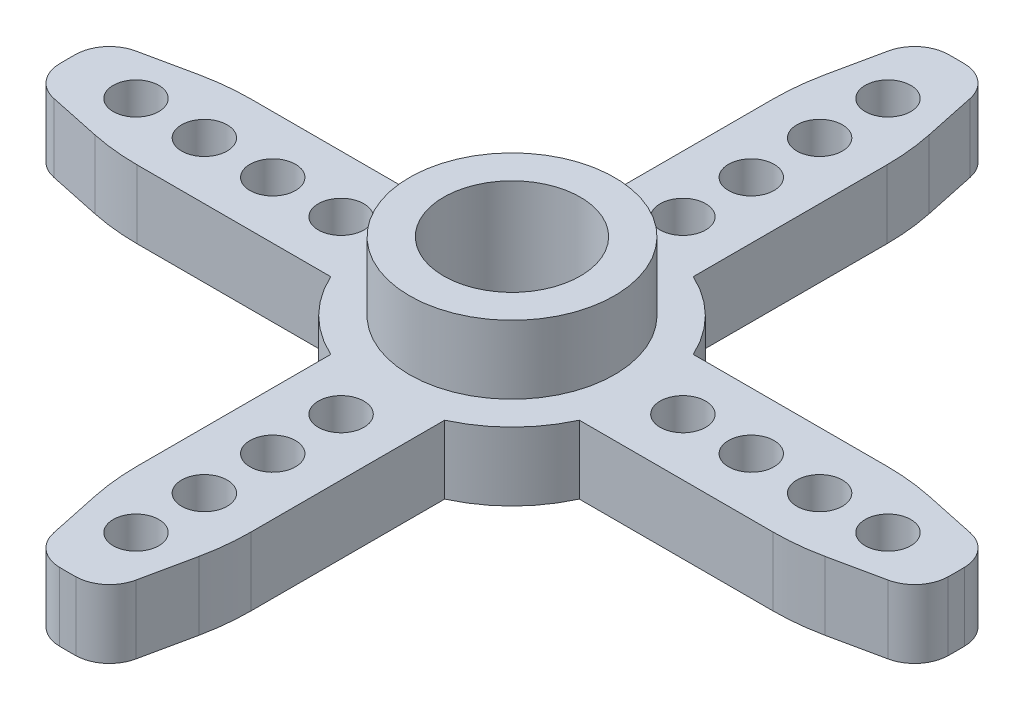
from build123d import *

# Parameters (mm, degrees)
SKETCH1_R           = 1
SKETCH1_R_2         = 4.5
BOSS_EXTRUDE1_DEPTH = 3
SKETCH1_4_R         = 4.5
SKETCH1_4_R_2       = 3
BOSS_EXTRUDE2_DEPTH = 6
BOSS_EXTRUDE3_START = -1
SKETCH1_5_R         = 4.5
SKETCH1_5_R_2       = 3
BOSS_EXTRUDE3_DEPTH = 1


with BuildPart() as part:
    # Sketch1 → Boss-Extrude1 (new body)
    with BuildSketch(Plane(origin=(0, 0, 0), x_dir=(1, 0, 0), z_dir=(0, 1, 0))):
        with BuildLine():
            ThreePointArc((-0.360965573, 19.496658787), (-1.288456839, 19.153411563), (-1.800704436, 18.307444008))
            Line((-1.800704436, 18.307444008), (-2.283369641, 16.026447288))
            ThreePointArc((-2.283369641, 16.026447288), (-2.445694958, 14.997005048), (-2.5, 13.956259259))
            Line((-2.5, 13.956259259), (-2.5, 5.454356057))
            ThreePointArc((-2.5, 5.454356057), (-4.242640687, 4.242640687), (-5.454356057, 2.5))
            Line((-5.454356057, 2.5), (-13.956259259, 2.5))
            ThreePointArc((-13.956259259, 2.5), (-14.997005048, 2.445694958), (-16.026447288, 2.283369641))
            Line((-16.026447288, 2.283369641), (-18.307444008, 1.800704436))
            ThreePointArc((-18.307444008, 1.800704436), (-19.153411563, 1.288456839), (-19.496658787, 0.360965573))
            ThreePointArc((-19.496658787, 0.360965573), (-19.5, 0), (-19.496658787, -0.360965573))
            ThreePointArc((-19.496658787, -0.360965573), (-19.153411563, -1.288456839), (-18.307444008, -1.800704436))
            Line((-18.307444008, -1.800704436), (-16.026447288, -2.283369641))
            ThreePointArc((-16.026447288, -2.283369641), (-14.997005048, -2.445694958), (-13.956259259, -2.5))
            Line((-13.956259259, -2.5), (-5.454356057, -2.5))
            ThreePointArc((-5.454356057, -2.5), (-4.242640687, -4.242640687), (-2.5, -5.454356057))
            Line((-2.5, -5.454356057), (-2.5, -13.956259259))
            ThreePointArc((-2.5, -13.956259259), (-2.445694958, -14.997005048), (-2.283369641, -16.026447288))
            Line((-2.283369641, -16.026447288), (-1.800704436, -18.307444008))
            ThreePointArc((-1.800704436, -18.307444008), (-1.288456839, -19.153411563), (-0.360965573, -19.496658787))
            ThreePointArc((-0.360965573, -19.496658787), (0, -19.5), (0.360965573, -19.496658787))
            ThreePointArc((0.360965573, -19.496658787), (1.288456839, -19.153411563), (1.800704436, -18.307444008))
            Line((1.800704436, -18.307444008), (2.283369641, -16.026447288))
            ThreePointArc((2.283369641, -16.026447288), (2.445694958, -14.997005048), (2.5, -13.956259259))
            Line((2.5, -13.956259259), (2.5, -5.454356057))
            ThreePointArc((2.5, -5.454356057), (4.242640687, -4.242640687), (5.454356057, -2.5))
            Line((5.454356057, -2.5), (13.956259259, -2.5))
            ThreePointArc((13.956259259, -2.5), (14.997005048, -2.445694958), (16.026447288, -2.283369641))
            Line((16.026447288, -2.283369641), (18.307444008, -1.800704436))
            ThreePointArc((18.307444008, -1.800704436), (19.153411563, -1.288456839), (19.496658787, -0.360965573))
            ThreePointArc((19.496658787, -0.360965573), (19.5, 0), (19.496658787, 0.360965573))
            ThreePointArc((19.496658787, 0.360965573), (19.153411563, 1.288456839), (18.307444008, 1.800704436))
            Line((18.307444008, 1.800704436), (16.026447288, 2.283369641))
            ThreePointArc((16.026447288, 2.283369641), (14.997005048, 2.445694958), (13.956259259, 2.5))
            Line((13.956259259, 2.5), (5.454356057, 2.5))
            ThreePointArc((5.454356057, 2.5), (4.242640687, 4.242640687), (2.5, 5.454356057))
            Line((2.5, 5.454356057), (2.5, 13.956259259))
            ThreePointArc((2.5, 13.956259259), (2.445694958, 14.997005048), (2.283369641, 16.026447288))
            Line((2.283369641, 16.026447288), (1.800704436, 18.307444008))
            ThreePointArc((1.800704436, 18.307444008), (1.288456839, 19.153411563), (0.360965573, 19.496658787))
            ThreePointArc((0.360965573, 19.496658787), (0, 19.5), (-0.360965573, 19.496658787))
        make_face()
        with Locations((-16.5, 0)):
            Circle(SKETCH1_R, mode=Mode.SUBTRACT)
        with Locations((-13.5, 0)):
            Circle(SKETCH1_R, mode=Mode.SUBTRACT)
        with Locations((-10.5, 0)):
            Circle(SKETCH1_R, mode=Mode.SUBTRACT)
        with Locations((-7.5, 0)):
            Circle(SKETCH1_R, mode=Mode.SUBTRACT)
        with Locations((0, -16.5)):
            Circle(SKETCH1_R, mode=Mode.SUBTRACT)
        with Locations((0, -13.5)):
            Circle(SKETCH1_R, mode=Mode.SUBTRACT)
        with Locations((0, -10.5)):
            Circle(SKETCH1_R, mode=Mode.SUBTRACT)
        with Locations((0, -7.5)):
            Circle(SKETCH1_R, mode=Mode.SUBTRACT)
        Circle(SKETCH1_R_2, mode=Mode.SUBTRACT)
        with Locations((7.5, 0)):
            Circle(SKETCH1_R, mode=Mode.SUBTRACT)
        with Locations((0, 7.5)):
            Circle(SKETCH1_R, mode=Mode.SUBTRACT)
        with Locations((10.5, 0)):
            Circle(SKETCH1_R, mode=Mode.SUBTRACT)
        with Locations((13.5, 0)):
            Circle(SKETCH1_R, mode=Mode.SUBTRACT)
        with Locations((16.5, 0)):
            Circle(SKETCH1_R, mode=Mode.SUBTRACT)
        with Locations((0, 10.5)):
            Circle(SKETCH1_R, mode=Mode.SUBTRACT)
        with Locations((0, 13.5)):
            Circle(SKETCH1_R, mode=Mode.SUBTRACT)
        with Locations((0, 16.5)):
            Circle(SKETCH1_R, mode=Mode.SUBTRACT)
    extrude(amount=BOSS_EXTRUDE1_DEPTH)

    # Sketch1<4> → Boss-Extrude2 (add)
    with BuildSketch(Plane(origin=(0, 0, 0), x_dir=(1, 0, 0), z_dir=(0, 1, 0))):
        Circle(SKETCH1_4_R)
        Circle(SKETCH1_4_R_2, mode=Mode.SUBTRACT)
    extrude(amount=BOSS_EXTRUDE2_DEPTH)

    # Sketch1<5> → Boss-Extrude3 (add)
    with BuildSketch(Plane(origin=(0, 0, 0), x_dir=(1, 0, 0), z_dir=(0, 1, 0)).offset(BOSS_EXTRUDE3_START)):
        Circle(SKETCH1_5_R)
        Circle(SKETCH1_5_R_2, mode=Mode.SUBTRACT)
    extrude(amount=BOSS_EXTRUDE3_DEPTH)


solid = part.part
